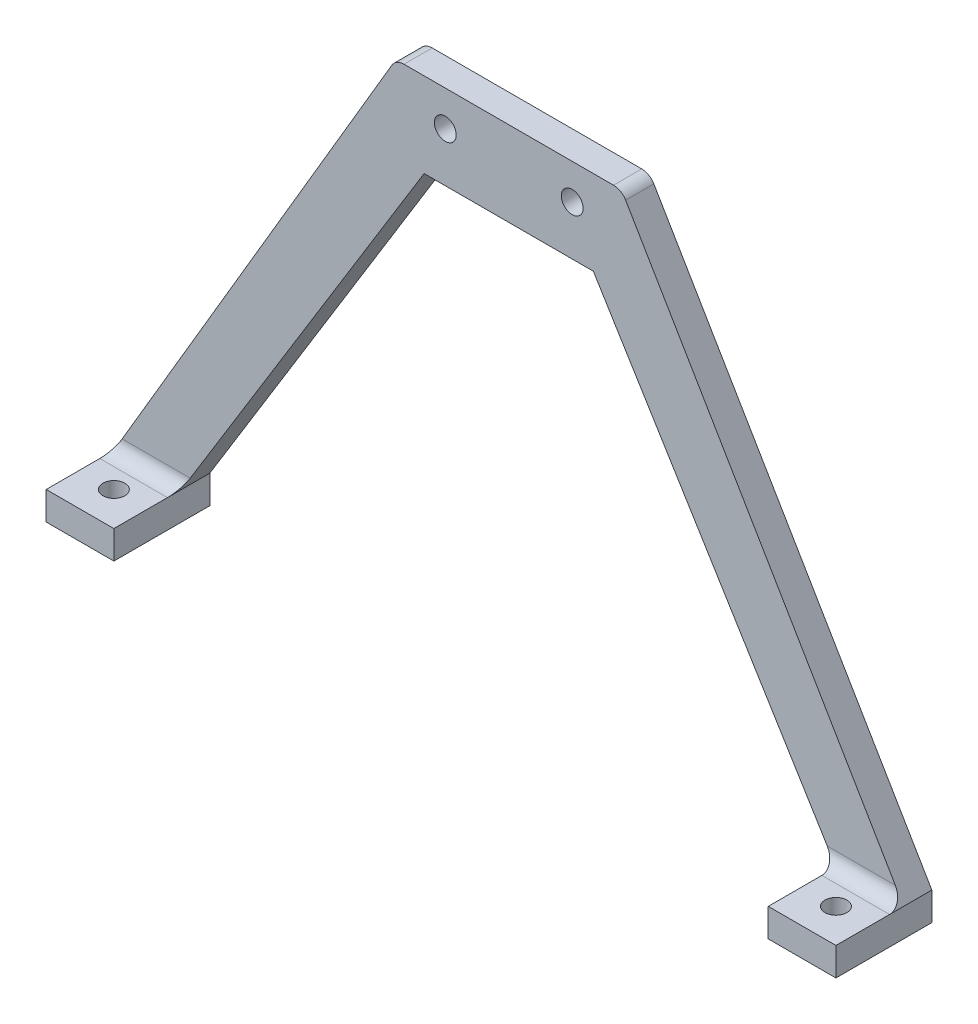
from build123d import *

# Parameters (mm, degrees)
SKETCH1_W           = 112
SKETCH1_H           = 72
BOSS_EXTRUDE1_DEPTH = 4
SKETCH2_W           = 9.6
SKETCH2_H           = 4
BOSS_EXTRUDE2_DEPTH = 9.6
SKETCH3_R           = 1.55
CUT_EXTRUDE1_DEPTH  = 9.6
SKETCH4_R           = 1.55
CUT_EXTRUDE2_DEPTH  = 9.6
CUT_EXTRUDE4_DEPTH  = 9.6
CUT_EXTRUDE5_DEPTH  = 9.6
CUT_EXTRUDE6_DEPTH  = 10
FILLET1_R           = 2
FILLET2_R           = 2


with BuildPart() as part:
    # Sketch1 → Boss-Extrude1 (new body)
    with BuildSketch(Plane.XY):
        with Locations((56, -36)):
            Rectangle(SKETCH1_W, SKETCH1_H)
    extrude(amount=BOSS_EXTRUDE1_DEPTH)

    # Sketch2 → Boss-Extrude2 (add)
    with BuildSketch(Plane.XY.offset(4)):
        with Locations((4.8, -70)):
            Rectangle(SKETCH2_W, SKETCH2_H)
        with Locations((107.2, -70)):
            Rectangle(SKETCH2_W, SKETCH2_H)
        with Locations((56, -70)):
            Rectangle(SKETCH2_W, SKETCH2_H)
    extrude(amount=BOSS_EXTRUDE2_DEPTH)

    # Sketch3 → Cut-Extrude1 (cut)
    with BuildSketch(Plane(origin=(0, -68, 0), x_dir=(1, 0, 0), z_dir=(0, 1, 0))):
        with Locations(Location((4.8, -8.8, 0), (0, 0, 270))):
            Circle(SKETCH3_R)
        with Locations(Location((56, -8.8, 0), (0, 0, 270))):
            Circle(SKETCH3_R)
        with Locations(Location((107.2, -8.8, 0), (0, 0, 270))):
            Circle(SKETCH3_R)
    extrude(amount=-CUT_EXTRUDE1_DEPTH, mode=Mode.SUBTRACT)

    # Sketch4 → Cut-Extrude2 (cut)
    with BuildSketch(Plane.XY.offset(4)):
        with Locations((47, -5)):
            Circle(SKETCH4_R)
        with Locations((65, -5)):
            Circle(SKETCH4_R)
        with Locations((56, -14)):
            Circle(SKETCH4_R)
    extrude(amount=-CUT_EXTRUDE2_DEPTH, mode=Mode.SUBTRACT)

    # Sketch5 → Cut-Extrude4 (cut)
    with BuildSketch(Plane.XY.offset(4)):
        Polygon((0, -68), (0, 0), (40, 0), align=None)
        Polygon((72, 0), (112, -68), (112, 0), align=None)
    extrude(amount=-CUT_EXTRUDE4_DEPTH, mode=Mode.SUBTRACT)

    # Sketch6 → Cut-Extrude5 (cut)
    with BuildSketch(Plane.XY.offset(4)):
        Polygon((9.6, -68), (44, -12), (51.2, -68), (51.2, -72), (9.6, -72), align=None)
        Polygon((102.4, -72), (102.4, -68), (68, -12), (60.8, -68), (60.8, -72), align=None)
    extrude(amount=-CUT_EXTRUDE5_DEPTH, mode=Mode.SUBTRACT)

    # Sketch7 → Cut-Extrude6 (cut)
    with BuildSketch(Plane.XY.offset(4)):
        Polygon((44, -12), (68, -12), (68, -81.921915354), (38.62828306, -80.469678764), align=None)
    extrude(amount=-CUT_EXTRUDE6_DEPTH, mode=Mode.SUBTRACT)


with BuildPart() as body_2:
    # of the pieces the cut leaves, the one that is kept (cut_extrude6_keep)
    add(part.part.solids().sort_by_distance((40, 0, 0))[0])

    # Fillet1
    fillet1_edges = [body_2.edges().sort_by_distance(p)[0] for p in [
        (4.8, -68, 4),
        (107.2, -68, 4),
    ]]
    fillet(fillet1_edges, radius=FILLET1_R)

    # Fillet2
    fillet2_edges = [body_2.edges().sort_by_distance(p)[0] for p in [
        (40, 0, 2),
        (72, 0, 2),
    ]]
    fillet(fillet2_edges, radius=FILLET2_R)


solid = body_2.part
